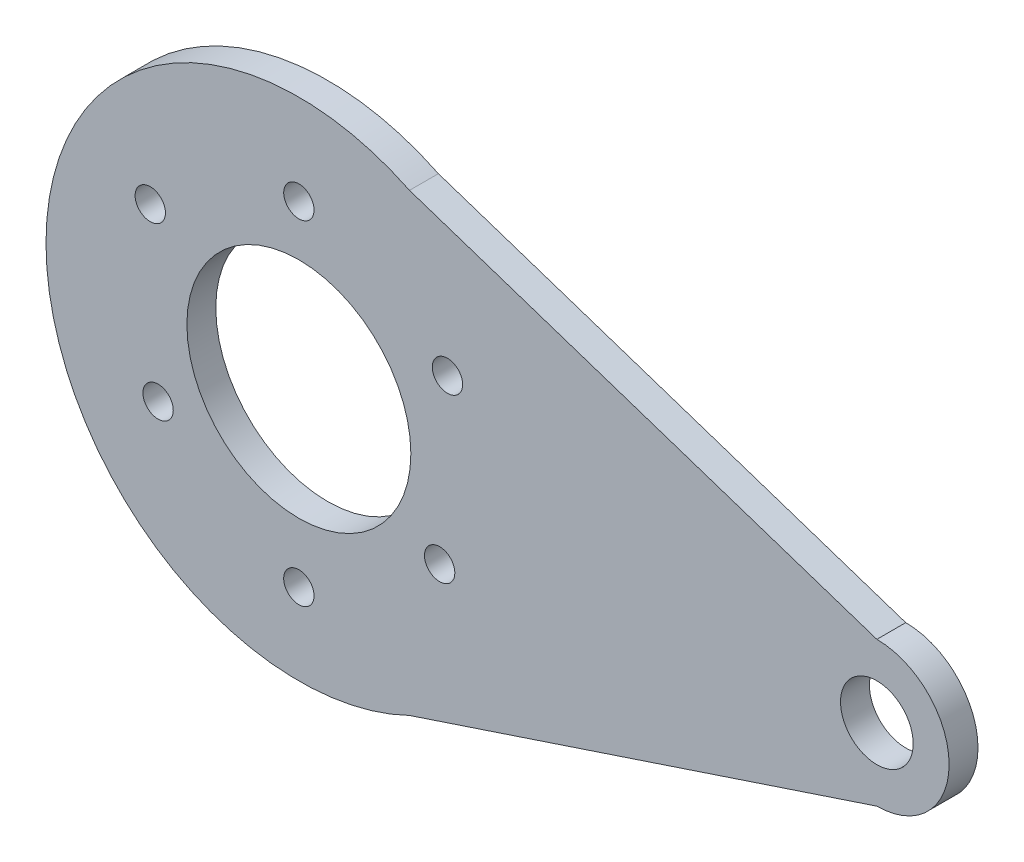
from build123d import *

# Parameters (mm, degrees)
SKETCH_2_R      = 2.1
SKETCH_2_R_2    = 15.5
SKETCH_2_R_3    = 5.03
EXTRUDE_1_DEPTH = 4


with BuildPart() as part:
    # 草图2 → 凸台-拉伸1 (new body)
    with BuildSketch(Plane.XY):
        with BuildLine():
            Line((82.574074367, 4.472412166), (17.886574367, 25.945056537))
            ThreePointArc((17.886574367, 25.945056537), (-32.425925633, -5.527587834), (17.886574367, -37.000232206))
            Line((17.886574367, -37.000232206), (82.574074367, -15.527587834))
            ThreePointArc((82.574074367, -15.527587834), (92.574074367, -5.527587834), (82.574074367, 4.472412166))
        make_face()
        with Locations((2.574074367, -29.277587834)):
            Circle(SKETCH_2_R, mode=Mode.SUBTRACT)
        with Locations((22.059645952, -16.777587834)):
            Circle(SKETCH_2_R, mode=Mode.SUBTRACT)
        with Locations((2.574074367, -5.527587834)):
            Circle(SKETCH_2_R_2, mode=Mode.SUBTRACT)
        with Locations((82.574074367, -5.527587834)):
            Circle(SKETCH_2_R_3, mode=Mode.SUBTRACT)
        with Locations((-17.994028973, 6.347412166)):
            Circle(SKETCH_2_R, mode=Mode.SUBTRACT)
        with Locations((23.142177707, 6.347412166)):
            Circle(SKETCH_2_R, mode=Mode.SUBTRACT)
        with Locations((2.574074367, 16.972412166)):
            Circle(SKETCH_2_R, mode=Mode.SUBTRACT)
        with Locations((-16.911497218, -16.777587834)):
            Circle(SKETCH_2_R, mode=Mode.SUBTRACT)
    extrude(amount=EXTRUDE_1_DEPTH)


solid = part.part
